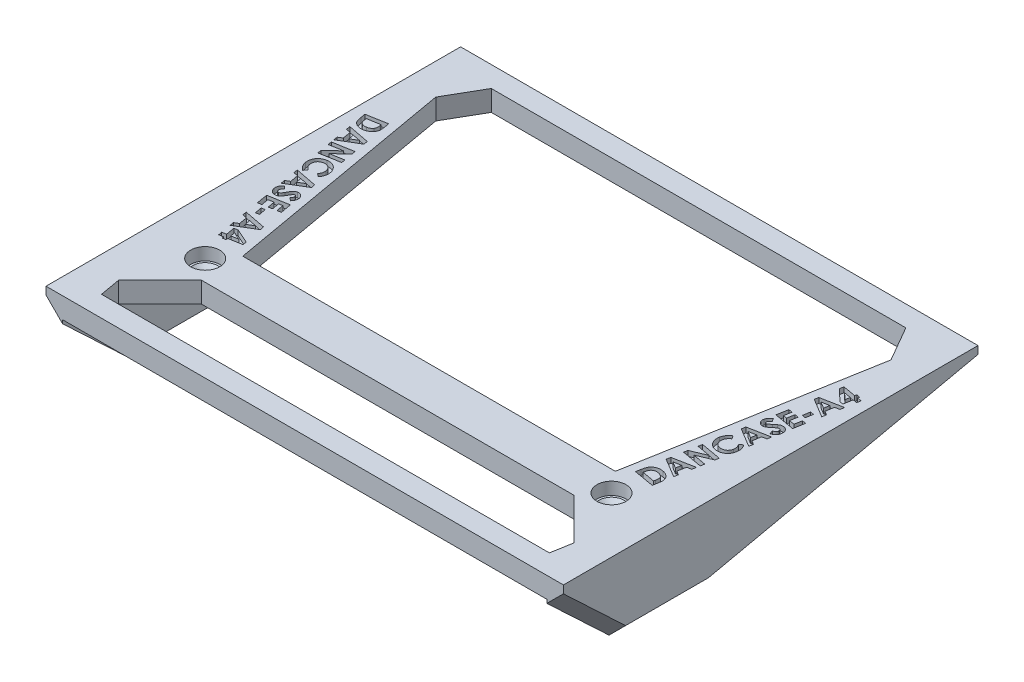
from build123d import *

# Parameters (mm, degrees)
BOSS_EXTRUDE1_DEPTH = 10
SKETCH2_R           = 3.5
CUT_EXTRUDE1_DEPTH  = 3
SKETCH3_R           = 1.5
CUT_EXTRUDE2_DEPTH  = 66.442799451
CHAMFER1_SIZE       = 1.5
CUT_EXTRUDE3_DEPTH  = 100.592971798
CUT_EXTRUDE4_DEPTH  = 1.25


with BuildPart() as part:
    # Sketch1 → Boss-Extrude1 (new, symmetric)
    with BuildSketch(Plane.XY):
        Polygon((-58.4, 0), (58.4, 0), (58.4, -15), (62.4, -11), (62.4, 5), (-62.4, 5), (-62.4, -11), (-58.4, -15), align=None)
    extrude(amount=BOSS_EXTRUDE1_DEPTH, both=True)

    # Sketch2 → Cut-Extrude1 (cut)
    with BuildSketch(Plane(origin=(0, 5, 0), x_dir=(1, 0, 0), z_dir=(0, 1, 0))):
        with Locations(Location((49, 0, 0), (0, 0, 270))):
            Circle(SKETCH2_R)
        with Locations(Location((-49, 0, 0), (0, 0, 180))):
            Circle(SKETCH2_R)
    extrude(amount=-CUT_EXTRUDE1_DEPTH, mode=Mode.SUBTRACT)

    # Sketch3 → Cut-Extrude2 (cut, through all)
    with BuildSketch(Plane(origin=(0, 2, 0), x_dir=(1, 0, 0), z_dir=(0, 1, 0))):
        with Locations(Location((49, 0, 0), (0, 0, 180))):
            Circle(SKETCH3_R)
        with Locations(Location((-49, 0, 0), (0, 0, 180))):
            Circle(SKETCH3_R)
    extrude(amount=-CUT_EXTRUDE2_DEPTH, mode=Mode.SUBTRACT)

    # Chamfer1
    chamfer1_edges = [part.edges().sort_by_distance(p)[0] for p in [
        (50.5, 2, 0),
        (-47.5, 2, 0),
    ]]
    chamfer(chamfer1_edges, length=CHAMFER1_SIZE)

    # Sketch4 → section 0 of loft1
    with BuildSketch(Plane.XY.offset(-75), mode=Mode.PRIVATE) as loft1_s0:
        with BuildLine():
            Line((58.4, -0.857864376), (62.4, 3.142135624))
            Line((62.4, 3.142135624), (62.4, 5))
            Line((62.4, 5), (-62.4, 5))
            Line((-62.4, 5), (-62.4, 3.142135624))
            Line((-62.4, 3.142135624), (-58.4, -0.857864376))
            Line((-58.4, -0.857864376), (-58.4, 0))
            Line((-58.4, 0), (58.4, 0))
            Line((58.4, 0), (58.4, -0.857864376))
        make_face()
    # loft up to a face of the part (loft1)
    loft([loft1_s0.sketch, part.faces().sort_by_distance((0, 1.206959707, -10))[0]])

    # Sketch5 → section 1 of loft2
    with BuildSketch(Plane.XY.offset(25), mode=Mode.PRIVATE) as loft2_s1:
        with BuildLine():
            Line((-58.4, 0), (58.4, 0))
            Line((58.4, 0), (58.4, -0.857864376))
            Line((58.4, -0.857864376), (62.4, 3.142135624))
            Line((62.4, 3.142135624), (62.4, 5))
            Line((62.4, 5), (-62.4, 5))
            Line((-62.4, 5), (-62.4, 3.142135624))
            Line((-62.4, 3.142135624), (-58.4, -0.857864376))
            Line((-58.4, -0.857864376), (-58.4, 0))
        make_face()
    # loft from a face of the part (loft2)
    loft([part.faces().sort_by_distance((0, 1.206959707, 10))[0], loft2_s1.sketch])

    # Sketch6 → Cut-Extrude3 (cut, through all)
    with BuildSketch(Plane(origin=(0, 5, 0), x_dir=(1, 0, 0), z_dir=(0, 1, 0))):
        Polygon((44.935241972, 5), (-44.935241972, 5), (-54.9, 61.512951043), (-50, 70), (50, 70), (54.9, 61.512951043), align=None)
        Polygon((44.935241972, -5), (-44.935241972, -5), (-54.9, -14.964758028), (-54.012150986, -20), (54.012150986, -20), (54.9, -14.964758028), align=None)
    extrude(amount=-CUT_EXTRUDE3_DEPTH, mode=Mode.SUBTRACT)

    # Sketch7 → Cut-Extrude4 (cut)
    # profile 1 of 20: a face of its own
    with BuildSketch(Plane(origin=(0, 5, 0), x_dir=(1, 0, 0), z_dir=(0, 1, 0))):
        with BuildLine():
            Line((47.42833982, 7.367029507), (47.622650718, 8.468792327))
            add(Edge.make_bspline(
                [(47.622650718, 8.468792327), (47.638306615, 8.5544052), (47.668634846, 8.72025241), (47.724158757, 8.958667131), (47.783670186, 9.179039778), (47.848439551, 9.380767009), (47.918583531, 9.563709433), (47.992910434, 9.728657213), (48.074216663, 9.874621764), (48.161442021, 10.003923584), (48.256163674, 10.120092643), (48.36003115, 10.226259076), (48.472187512, 10.325780391), (48.594308351, 10.417232851), (48.725458575, 10.501397063), (48.866387434, 10.57732929), (49.015721662, 10.646708143), (49.173730225, 10.707311838), (49.338294731, 10.759869876), (49.508896292, 10.799454873), (49.683848712, 10.828538222), (49.86313783, 10.847079918), (50.046898221, 10.851322673), (50.234461126, 10.845168068), (50.426559036, 10.828687971), (50.555116721, 10.80802089), (50.620447192, 10.797518289)],
                knots=[0, 0, 0, 0, 1.43894904, 2.787497666, 4.046405404, 5.212640783, 6.289158376, 7.284733822, 8.201664698, 9.048418289, 9.860633328, 10.676592175, 11.501836242, 12.337667263, 13.196784439, 14.076219577, 14.982720569, 15.917737894, 16.872814779, 17.83695933, 18.810807138, 19.803991875, 20.814652542, 21.847550151, 22.906167595, 24, 24, 24, 24], degree=3))
            add(Edge.make_bspline(
                [(50.620447192, 10.797518289), (50.712352249, 10.778861633), (50.89289144, 10.742212316), (51.1522676, 10.658857208), (51.39655707, 10.555889151), (51.622992449, 10.430465427), (51.831573922, 10.289073695), (52.017867509, 10.13148383), (52.180562724, 9.959141508), (52.318296566, 9.773932686), (52.432291087, 9.580970916), (52.522915673, 9.383900954), (52.585843973, 9.183146156), (52.620102916, 9.01117281), (52.633628194, 8.864318727), (52.634332782, 8.737185565), (52.630501371, 8.593177597), (52.619143248, 8.432146806), (52.600358121, 8.25425477), (52.577013603, 8.059377246), (52.543952508, 7.847563975), (52.519305876, 7.700869925), (52.50646482, 7.624441366)],
                knots=[0, 0, 0, 0, 1.321459185, 2.595887311, 3.83402008, 5.053949924, 6.239553283, 7.381802014, 8.487455182, 9.573971328, 10.629196974, 11.6425549, 12.625190949, 13.589064158, 14.109034805, 14.702266248, 15.380421129, 16.140110551, 16.977652082, 17.902559346, 18.907219703, 20, 20, 20, 20], degree=3))
            Line((52.50646482, 7.624441366), (52.309149115, 6.506652904))
            Line((52.309149115, 6.506652904), (47.42833982, 7.367029507))
        make_face()
        with BuildLine():
            Line((48.488035333, 8.135258673), (51.562955205, 7.592390084))
            Line((51.562955205, 7.592390084), (51.639077, 8.024080789))
            add(Edge.make_bspline(
                [(51.639077, 8.024080789), (51.647853289, 8.075432694), (51.664792975, 8.174550342), (51.682313909, 8.318649662), (51.695165504, 8.452540179), (51.700022597, 8.57625406), (51.699267617, 8.690251816), (51.692877557, 8.794058456), (51.679236175, 8.888017866), (51.650922056, 8.999301813), (51.598599278, 9.129211533), (51.508926048, 9.274528364), (51.390236907, 9.409185142), (51.272901081, 9.512773649), (51.166142203, 9.588978667), (51.079027815, 9.643228254), (50.985573281, 9.692275372), (50.886172304, 9.736351151), (50.780766787, 9.775369362), (50.669380833, 9.8093657), (50.551929866, 9.838340627), (50.47128191, 9.854022194), (50.430142705, 9.862021494)],
                knots=[0, 0, 0, 0, 1.226141472, 2.366655304, 3.416158048, 4.391475138, 5.279585264, 6.098778276, 6.837907361, 7.510765269, 8.797951066, 10.117550192, 11.510447721, 13.008317936, 13.791272628, 14.596012632, 15.422150468, 16.273582384, 17.153868831, 18.06623251, 19.013568814, 20, 20, 20, 20], degree=3))
            add(Edge.make_bspline(
                [(50.430142705, 9.862021494), (50.367173539, 9.872114394), (50.244396511, 9.891793491), (50.062334498, 9.902603138), (49.888705586, 9.897868549), (49.723652267, 9.878050959), (49.566981135, 9.843225447), (49.418895731, 9.79167963), (49.278611457, 9.725079399), (49.19287754, 9.668099711), (49.150094628, 9.639665725)],
                knots=[0, 0, 0, 0, 1.145761577, 2.234001365, 3.272660155, 4.264165347, 5.217787166, 6.151563543, 7.077593818, 8, 8, 8, 8], degree=3))
            add(Edge.make_bspline(
                [(49.150094628, 9.639665725), (49.11279623, 9.610967178), (49.037053922, 9.552688691), (48.938116846, 9.444060608), (48.847390221, 9.320392848), (48.767540252, 9.178752949), (48.696549903, 9.020745509), (48.634824243, 8.846189813), (48.582484388, 8.654649911), (48.556568965, 8.520410065), (48.543123474, 8.450763481)],
                knots=[0, 0, 0, 0, 0.824231297, 1.67377647, 2.5664853, 3.51094025, 4.520192374, 5.602122178, 6.755928253, 8, 8, 8, 8], degree=3))
            Line((48.543123474, 8.450763481), (48.488035333, 8.135258673))
        make_face(mode=Mode.SUBTRACT)
    # profile 2 of 20: a face of its own
    with BuildSketch(Plane(origin=(0, 5, 0), x_dir=(1, 0, 0), z_dir=(0, 1, 0))):
        Polygon((48.535736391, 13.648184265), (48.702002416, 14.589690675), (53.913340557, 15.60731888), (53.743068122, 14.641774009), (52.670351775, 14.437447086), (52.319790878, 12.447262791), (53.255287673, 11.871341316), (53.085015237, 10.905796445), align=None)
        Polygon((49.913941519, 13.898584906), (51.474438314, 12.95106888), (51.703805301, 14.248144201), align=None, mode=Mode.SUBTRACT)
    # profile 3 of 20: a face of its own
    with BuildSketch(Plane(origin=(0, 5, 0), x_dir=(1, 0, 0), z_dir=(0, 1, 0))):
        Polygon((49.164821597, 17.215107037), (49.321071597, 18.104530114), (52.902802366, 19.631974024), (49.690662943, 20.197879473), (49.853924161, 21.12636505), (54.734733456, 20.265988447), (54.577481853, 19.373560563), (51.006768712, 17.848119857), (54.20889211, 17.283216011), (54.045630892, 16.354730434), align=None)
    # profile 4 of 20: a face of its own
    with BuildSketch(Plane(origin=(0, 5, 0), x_dir=(1, 0, 0), z_dir=(0, 1, 0))):
        with BuildLine():
            Line((51.704964495, 26.596332693), (52.211775392, 25.83711795))
            add(Edge.make_bspline(
                [(52.211775392, 25.83711795), (52.146013047, 25.792005508), (52.017545187, 25.703877586), (51.845543542, 25.552665051), (51.691183748, 25.396016747), (51.561102856, 25.227294106), (51.449112247, 25.051301722), (51.360384711, 24.865106367), (51.290234628, 24.670318367), (51.262318315, 24.53513139), (51.248233726, 24.466925642)],
                knots=[0, 0, 0, 0, 1.109145889, 2.166735341, 3.182318407, 4.165878283, 5.126508307, 6.080607003, 7.031610598, 8, 8, 8, 8], degree=3))
            add(Edge.make_bspline(
                [(51.248233726, 24.466925642), (51.239480822, 24.409288874), (51.222294816, 24.296121184), (51.215244825, 24.126598235), (51.225776331, 23.961662045), (51.250168218, 23.800355474), (51.292714456, 23.643676132), (51.351278922, 23.491397627), (51.425938266, 23.343542189), (51.515578437, 23.201441639), (51.617733436, 23.067889223), (51.731406041, 22.94734789), (51.854153491, 22.840082457), (51.987282524, 22.747882643), (52.129390136, 22.668179449), (52.280828892, 22.601868371), (52.442443374, 22.550374172), (52.55440771, 22.527467085), (52.611414816, 22.515803847)],
                knots=[0, 0, 0, 0, 1.053454785, 2.068419994, 3.060199017, 4.037712953, 5.012894473, 5.989289544, 6.982702064, 8.002609267, 9.022802229, 10.017754015, 10.993309096, 11.964522034, 12.940114463, 13.9348465, 14.94851853, 16, 16, 16, 16], degree=3))
            add(Edge.make_bspline(
                [(52.611414816, 22.515803847), (52.651740892, 22.509234943), (52.731104608, 22.496307015), (52.84995805, 22.486779089), (52.966325035, 22.483552536), (53.080403416, 22.487511976), (53.192154877, 22.498512479), (53.301533409, 22.51666534), (53.40916935, 22.54135436), (53.513873907, 22.574980021), (53.616063754, 22.613265712), (53.713930329, 22.66002142), (53.807390606, 22.712925284), (53.89749494, 22.771200269), (53.98282529, 22.836573478), (54.063825364, 22.908887214), (54.141114314, 22.987165118), (54.213999213, 23.071165657), (54.282302781, 23.160213811), (54.344065779, 23.254022871), (54.399443761, 23.351810764), (54.448612715, 23.453182917), (54.491684732, 23.558587103), (54.528765975, 23.667540758), (54.559185704, 23.780654212), (54.574033271, 23.857845985), (54.581567059, 23.897013783)],
                knots=[0, 0, 0, 0, 1.090569344, 2.146294516, 3.180765, 4.197685383, 5.192082883, 6.176964013, 7.156545369, 8.137748013, 9.111266311, 10.068317995, 11.030339259, 11.977373555, 12.931306106, 13.897449159, 14.874552872, 15.866669961, 16.865174993, 17.869038234, 18.863115991, 19.863886878, 20.875400364, 21.901578752, 22.935242242, 24, 24, 24, 24], degree=3))
            add(Edge.make_bspline(
                [(54.581567059, 23.897013783), (54.591322694, 23.963318004), (54.610517809, 24.093777693), (54.614709276, 24.289243444), (54.60064169, 24.479451806), (54.569387887, 24.634172262), (54.535215407, 24.757473629), (54.500312716, 24.852741673), (54.459376999, 24.952218033), (54.41035172, 25.054748167), (54.353671917, 25.160375922), (54.290369921, 25.269495944), (54.220688178, 25.38292632), (54.169237609, 25.458060756), (54.142865136, 25.496573078)],
                knots=[0, 0, 0, 0, 1.410720845, 2.775723772, 4.109284949, 5.421133388, 6.093584563, 6.803297754, 7.556994136, 8.359274766, 9.196292425, 10.081820413, 11.016781733, 12, 12, 12, 12], degree=3))
            Line((54.142865136, 25.496573078), (54.909091098, 26.010395193))
            add(Edge.make_bspline(
                [(54.909091098, 26.010395193), (54.943925204, 25.958597382), (55.012123482, 25.85718753), (55.104673835, 25.703564882), (55.189584065, 25.554483248), (55.263567054, 25.408314974), (55.327945613, 25.266027959), (55.382369471, 25.127699493), (55.426514063, 24.992850364), (55.462510928, 24.860601232), (55.487794915, 24.728158851), (55.508809924, 24.594331195), (55.520216076, 24.457108264), (55.52520205, 24.316733717), (55.523521765, 24.172941287), (55.512636992, 24.026331941), (55.497477267, 23.876095241), (55.480579599, 23.775740954), (55.471991739, 23.724738142)],
                knots=[0, 0, 0, 0, 1.234899529, 2.417688632, 3.547625029, 4.628913742, 5.657840593, 6.636778781, 7.56848357, 8.464225141, 9.346492087, 10.23496948, 11.143457728, 12.068888497, 13.013640044, 13.986967584, 14.976921486, 16, 16, 16, 16], degree=3))
            add(Edge.make_bspline(
                [(55.471991739, 23.724738142), (55.453629169, 23.632189045), (55.417705501, 23.451130348), (55.336467646, 23.19094711), (55.235422527, 22.947734878), (55.113923795, 22.721024621), (54.971623178, 22.511531519), (54.810231105, 22.317836043), (54.62608391, 22.143105535), (54.424877861, 21.985767758), (54.209708735, 21.848414407), (53.982616516, 21.736930168), (53.747236074, 21.648982262), (53.502729325, 21.586796118), (53.249623923, 21.550031526), (52.988051241, 21.536873139), (52.717687094, 21.54996962), (52.536444153, 21.577370788), (52.444147187, 21.591324681)],
                knots=[0, 0, 0, 0, 1.088874197, 2.130222217, 3.141162033, 4.12604602, 5.094794562, 6.060777659, 7.031480291, 8.02014469, 9.006227626, 9.973448469, 10.93588638, 11.902699941, 12.880800108, 13.884391936, 14.922638296, 16, 16, 16, 16], degree=3))
            add(Edge.make_bspline(
                [(52.444147187, 21.591324681), (52.384222363, 21.602945691), (52.266243052, 21.625825003), (52.093943908, 21.672417335), (51.928753545, 21.728458479), (51.770134955, 21.793602246), (51.618079318, 21.867947836), (51.473095099, 21.951857747), (51.334921751, 22.045677547), (51.204270921, 22.148645341), (51.080648306, 22.259626305), (50.966698713, 22.379537813), (50.859342828, 22.505696786), (50.763291152, 22.641425488), (50.672699985, 22.782962282), (50.593465411, 22.933649236), (50.520701175, 23.09112637), (50.458086178, 23.255859701), (50.405512441, 23.424844976), (50.362934951, 23.596015869), (50.332168815, 23.768022661), (50.311547451, 23.941245389), (50.303929884, 24.115635392), (50.307050004, 24.290879937), (50.320400603, 24.467346445), (50.339270675, 24.58422015), (50.348794623, 24.643207693)],
                knots=[0, 0, 0, 0, 1.063434692, 2.093678088, 3.107427516, 4.101417927, 5.079756669, 6.054698874, 7.018063005, 7.987591385, 8.951517532, 9.910285425, 10.868258636, 11.835410031, 12.805496855, 13.79455428, 14.799450125, 15.827012326, 16.863022115, 17.881817548, 18.898634203, 19.906069982, 20.919468756, 21.9377657, 22.959165924, 24, 24, 24, 24], degree=3))
            add(Edge.make_bspline(
                [(50.348794623, 24.643207693), (50.358245514, 24.69307689), (50.377137473, 24.792763447), (50.415574549, 24.93984276), (50.461522984, 25.084359209), (50.51597647, 25.225551774), (50.576936122, 25.364203973), (50.646150128, 25.499660804), (50.723895092, 25.631862326), (50.807216286, 25.761823103), (50.898623365, 25.887147145), (50.996337208, 26.006783199), (51.099952443, 26.120497495), (51.209204609, 26.22795304), (51.324923114, 26.328735926), (51.444798385, 26.425818176), (51.572198307, 26.514599848), (51.66062895, 26.569039071), (51.704964495, 26.596332693)],
                knots=[0, 0, 0, 0, 0.992998121, 1.984964064, 2.972596045, 3.959038798, 4.944788975, 5.935312371, 6.933711921, 7.944919204, 8.955070661, 9.967290502, 10.966224315, 11.964132089, 12.964090888, 13.968096654, 14.981285913, 16, 16, 16, 16], degree=3))
        make_face()
    # profile 5 of 20: a face of its own
    with BuildSketch(Plane(origin=(0, 5, 0), x_dir=(1, 0, 0), z_dir=(0, 1, 0))):
        Polygon((51.25177199, 29.051587581), (51.418038016, 29.993093992), (56.629376157, 31.010722197), (56.459103721, 30.045177325), (55.386387375, 29.840850402), (55.035826477, 27.850666107), (55.971323272, 27.274744633), (55.801050836, 26.309199761), align=None)
        Polygon((52.629977118, 29.301988222), (54.190473913, 28.354472197), (54.4198409, 29.651547517), align=None, mode=Mode.SUBTRACT)
    # profile 6 of 20: a face of its own
    with BuildSketch(Plane(origin=(0, 5, 0), x_dir=(1, 0, 0), z_dir=(0, 1, 0))):
        with BuildLine():
            Line((52.994639247, 35.055409392), (53.481418094, 34.263141764))
            add(Edge.make_bspline(
                [(53.481418094, 34.263141764), (53.436352602, 34.240381736), (53.349672108, 34.196604329), (53.230295453, 34.123934264), (53.127164404, 34.04730616), (53.038895201, 33.968108425), (52.966068709, 33.884954442), (52.909245464, 33.798113685), (52.867396022, 33.708086663), (52.85333933, 33.645159254), (52.846402068, 33.614103302)],
                knots=[0, 0, 0, 0, 1.285749291, 2.473053752, 3.554849919, 4.554281387, 5.48874798, 6.361541685, 7.191387603, 8, 8, 8, 8], degree=3))
            add(Edge.make_bspline(
                [(52.846402068, 33.614103302), (52.842490523, 33.584787908), (52.834948732, 33.528265336), (52.838681858, 33.445130001), (52.856957834, 33.367906714), (52.888990545, 33.298626224), (52.930013288, 33.239071505), (52.978343979, 33.192412209), (53.032158402, 33.158542256), (53.072044105, 33.148381498), (53.091794696, 33.143350097)],
                knots=[0, 0, 0, 0, 1.208451578, 2.329997416, 3.383678211, 4.435142688, 5.435675797, 6.324595447, 7.170373652, 8, 8, 8, 8], degree=3))
            add(Edge.make_bspline(
                [(53.091794696, 33.143350097), (53.112471002, 33.140968262), (53.153492297, 33.136242759), (53.216219331, 33.141844353), (53.278518317, 33.157752072), (53.318068252, 33.176088772), (53.338188927, 33.185417405)],
                knots=[0, 0, 0, 0, 0.980524547, 1.945337204, 2.954708694, 4, 4, 4, 4], degree=3))
            add(Edge.make_bspline(
                [(53.338188927, 33.185417405), (53.354350757, 33.194547359), (53.391888723, 33.215752872), (53.45198255, 33.257827574), (53.526759192, 33.309639546), (53.613614136, 33.374789166), (53.712220212, 33.453807038), (53.826021526, 33.542008078), (53.950834457, 33.645158892), (54.038947159, 33.717306126), (54.08538444, 33.755329264)],
                knots=[0, 0, 0, 0, 0.473391609, 1.09951395, 1.869988968, 2.795139647, 3.868821269, 5.094176913, 6.468569017, 8, 8, 8, 8], degree=3))
            add(Edge.make_bspline(
                [(54.08538444, 33.755329264), (54.128155926, 33.791008946), (54.209694209, 33.859027627), (54.32474375, 33.956153531), (54.428961586, 34.040418351), (54.519209701, 34.114155793), (54.597342857, 34.176905736), (54.66209982, 34.228901161), (54.715970989, 34.267940889), (54.74711061, 34.290518741), (54.760464568, 34.300201058)],
                knots=[0, 0, 0, 0, 1.540578673, 2.936913192, 4.164241334, 5.247334312, 6.160222991, 6.936123831, 7.54376588, 8, 8, 8, 8], degree=3))
            add(Edge.make_bspline(
                [(54.760464568, 34.300201058), (54.8146372, 34.336539564), (54.918338133, 34.406101202), (55.076699172, 34.491159687), (55.227179473, 34.558790809), (55.373639957, 34.606044861), (55.518946842, 34.634220324), (55.665618124, 34.647738633), (55.815833661, 34.643543453), (55.915752221, 34.629057442), (55.966394055, 34.621715482)],
                knots=[0, 0, 0, 0, 1.218177266, 2.331917688, 3.354236522, 4.29727151, 5.200165954, 6.114559973, 7.04440036, 8, 8, 8, 8], degree=3))
            add(Edge.make_bspline(
                [(55.966394055, 34.621715482), (56.015419799, 34.612140627), (56.111432992, 34.593389003), (56.248495342, 34.54683779), (56.377277973, 34.490770739), (56.498421535, 34.424143019), (56.609187801, 34.343062251), (56.71058618, 34.250105934), (56.804475194, 34.146623165), (56.888038331, 34.031594832), (56.960831565, 33.908325471), (57.020632244, 33.778194707), (57.065336674, 33.642307424), (57.098124922, 33.500913788), (57.115421028, 33.353497618), (57.120508776, 33.200382994), (57.111738965, 33.041749404), (57.094814572, 32.93523584), (57.086185722, 32.880930225)],
                knots=[0, 0, 0, 0, 1.031511158, 2.020136198, 2.984347577, 3.932846471, 4.871527866, 5.814385981, 6.772104614, 7.754931499, 8.747978864, 9.726945561, 10.709021022, 11.700124034, 12.722195738, 13.771764204, 14.863940795, 16, 16, 16, 16], degree=3))
            add(Edge.make_bspline(
                [(57.086185722, 32.880930225), (57.078139831, 32.838385268), (57.062233315, 32.754275001), (57.02767657, 32.632281587), (56.986759241, 32.515756581), (56.938540645, 32.404777443), (56.882455918, 32.299699823), (56.818917192, 32.2001065), (56.748955774, 32.105744086), (56.671135533, 32.017124305), (56.586037058, 31.933312678), (56.490831285, 31.856656224), (56.389140666, 31.783033917), (56.27772667, 31.716158977), (56.158846174, 31.652556886), (56.030210823, 31.59617933), (55.893939002, 31.543668602), (55.799303055, 31.5138982), (55.751049504, 31.498718687)],
                knots=[0, 0, 0, 0, 1.018636842, 2.013818363, 2.980581377, 3.923646487, 4.858722858, 5.78079965, 6.701737373, 7.620560733, 8.554084067, 9.508893821, 10.494505617, 11.506574856, 12.564607393, 13.665622948, 14.80973366, 16, 16, 16, 16], degree=3))
            Line((55.751049504, 31.498718687), (55.416514247, 32.361098494))
            add(Edge.make_bspline(
                [(55.416514247, 32.361098494), (55.472586848, 32.38131291), (55.579958842, 32.420020979), (55.729250848, 32.488596756), (55.857993697, 32.56584897), (55.968241626, 32.649156621), (56.058290287, 32.740520071), (56.128633426, 32.839131685), (56.181025326, 32.944464487), (56.198204472, 33.019674554), (56.206778671, 33.057212276)],
                knots=[0, 0, 0, 0, 1.293310528, 2.476527398, 3.558889411, 4.545851864, 5.468163893, 6.330702383, 7.166845179, 8, 8, 8, 8], degree=3))
            add(Edge.make_bspline(
                [(56.206778671, 33.057212276), (56.211714947, 33.095863531), (56.221278419, 33.170745917), (56.214410568, 33.282231343), (56.186886454, 33.387256209), (56.140707726, 33.482778113), (56.083293623, 33.567336882), (56.012713488, 33.632517878), (55.933516856, 33.680758436), (55.874814818, 33.695039602), (55.845200145, 33.702244328)],
                knots=[0, 0, 0, 0, 1.14189739, 2.212295646, 3.255797914, 4.30787034, 5.313837171, 6.236129281, 7.110142426, 8, 8, 8, 8], degree=3))
            add(Edge.make_bspline(
                [(55.845200145, 33.702244328), (55.817189338, 33.705608846), (55.760145577, 33.712460656), (55.671494969, 33.703310536), (55.580905155, 33.678582296), (55.503999741, 33.645559462), (55.437927085, 33.609741599), (55.380495776, 33.573821513), (55.316226712, 33.528952994), (55.243907686, 33.477220053), (55.165235733, 33.415801736), (55.07907224, 33.346708866), (54.985939116, 33.269541626), (54.921981588, 33.214886039), (54.888669696, 33.186419007)],
                knots=[0, 0, 0, 0, 0.904452762, 1.841910027, 2.84136589, 3.913571025, 4.523301456, 5.255783202, 6.089146778, 7.042134486, 8.113104021, 9.296192041, 10.591737991, 12, 12, 12, 12], degree=3))
            add(Edge.make_bspline(
                [(54.888669696, 33.186419007), (54.825067596, 33.132134837), (54.702644012, 33.027646734), (54.52401414, 32.880615875), (54.357517198, 32.749820993), (54.202980147, 32.635597759), (54.061704791, 32.536001213), (53.931709565, 32.453692869), (53.81528692, 32.385364397), (53.677129025, 32.320041967), (53.514815296, 32.260712223), (53.323864618, 32.219381298), (53.1374799, 32.203208745), (53.016921721, 32.219074317), (52.957579953, 32.226883751)],
                knots=[0, 0, 0, 0, 1.351034414, 2.600519106, 3.737913985, 4.771508269, 5.705306867, 6.5298796, 7.257188875, 7.884545825, 8.997108281, 10.040370523, 11.035421071, 12, 12, 12, 12], degree=3))
            add(Edge.make_bspline(
                [(52.957579953, 32.226883751), (52.9163147, 32.235424479), (52.834705992, 32.252315148), (52.716913931, 32.291495527), (52.60642884, 32.343448016), (52.501279632, 32.404257301), (52.403504367, 32.477988163), (52.313669765, 32.564006114), (52.228537203, 32.659409217), (52.152619396, 32.765830225), (52.085609997, 32.879326855), (52.030336104, 32.998082706), (51.986757335, 33.120384095), (51.95730086, 33.246798862), (51.937030927, 33.376371871), (51.933592344, 33.50995687), (51.938328428, 33.647144225), (51.952676536, 33.738732757), (51.959983799, 33.78537734)],
                knots=[0, 0, 0, 0, 0.981519677, 1.941113814, 2.884515, 3.822639276, 4.767226909, 5.730441872, 6.717129097, 7.742835048, 8.771693898, 9.784660248, 10.791151222, 11.791367028, 12.805915929, 13.841490314, 14.90070532, 16, 16, 16, 16], degree=3))
            add(Edge.make_bspline(
                [(51.959983799, 33.78537734), (51.972883956, 33.845205533), (51.998555911, 33.964266615), (52.0628877, 34.135396895), (52.147081278, 34.298064528), (52.232958555, 34.427100004), (52.313945869, 34.526836622), (52.38476259, 34.602242033), (52.464384147, 34.677785985), (52.553446636, 34.753084023), (52.650425467, 34.829266789), (52.756852195, 34.905214398), (52.872053324, 34.98148859), (52.953053555, 35.030332714), (52.994639247, 35.055409392)],
                knots=[0, 0, 0, 0, 1.297959113, 2.583003275, 3.86689359, 5.18009119, 5.865323284, 6.592493127, 7.374619854, 8.194167617, 9.067605864, 9.992096453, 10.969138011, 12, 12, 12, 12], degree=3))
        make_face()
    # profile 7 of 20: a face of its own
    with BuildSketch(Plane(origin=(0, 5, 0), x_dir=(1, 0, 0), z_dir=(0, 1, 0))):
        Polygon((52.504209629, 36.153717672), (52.973961231, 38.817980492), (53.88341636, 38.657724082), (53.575924372, 36.915937223), (54.458336231, 36.760688826), (54.765828219, 38.502475685), (55.658256103, 38.345224082), (55.350764116, 36.603437223), (56.634818603, 36.377075044), (56.94231059, 38.118861903), (57.854770526, 37.95760389), (57.385018924, 35.293341069), align=None)
    # profile 8 of 20: a face of its own
    with BuildSketch(Plane(origin=(0, 5, 0), x_dir=(1, 0, 0), z_dir=(0, 1, 0))):
        Polygon((55.792826485, 39.243211849), (56.090302446, 40.928908965), (56.932650202, 40.779670183), (56.635174241, 39.093973067), align=None)
    # profile 9 of 20: a face of its own
    with BuildSketch(Plane(origin=(0, 5, 0), x_dir=(1, 0, 0), z_dir=(0, 1, 0))):
        Polygon((53.889888535, 44.013089983), (54.056154561, 44.954596393), (59.267492702, 45.972224598), (59.097220266, 45.006679727), (58.02450392, 44.802352803), (57.673943023, 42.812168509), (58.609439818, 42.236247034), (58.439167382, 41.270702162), align=None)
        Polygon((55.268093664, 44.263490624), (56.828590459, 43.315974598), (57.057957446, 44.613049919), align=None, mode=Mode.SUBTRACT)
    # profile 10 of 20: a face of its own
    with BuildSketch(Plane(origin=(0, 5, 0), x_dir=(1, 0, 0), z_dir=(0, 1, 0))):
        Polygon((54.69425419, 49.290749934), (54.858517011, 50.219235511), (58.000544254, 49.665349293), (58.076666049, 50.100044806), (58.936041049, 49.947801216), (58.859919254, 49.513105704), (59.861521818, 49.336823652), (59.701265408, 48.428370127), (58.699662844, 48.604652178), (58.324061883, 46.474243524), (57.464686883, 46.626487114), align=None)
        Polygon((57.840287844, 48.756895768), (56.204670857, 49.045357306), (57.642972139, 47.642112114), align=None, mode=Mode.SUBTRACT)
    # profile 11 of 20: a face of its own
    with BuildSketch(Plane(origin=(0, 5, 0), x_dir=(1, 0, 0), z_dir=(0, 1, 0))):
        Polygon((-47.478228644, 8.366290095), (-47.313965824, 7.437804518), (-50.455993068, 6.8839183), (-50.379871273, 6.449222788), (-51.239246273, 6.296979198), (-51.315368068, 6.731674711), (-52.316970632, 6.555392659), (-52.477227042, 7.463846185), (-51.475624478, 7.640128236), (-51.851225439, 9.77053689), (-50.991850439, 9.92278048), align=None)
        Polygon((-50.616249478, 7.792371826), (-48.980632491, 8.080833365), (-50.813565183, 8.90715548), align=None, mode=Mode.SUBTRACT)
    # profile 12 of 20: a face of its own
    with BuildSketch(Plane(origin=(0, 5, 0), x_dir=(1, 0, 0), z_dir=(0, 1, 0))):
        Polygon((-48.526985325, 13.599879534), (-48.360719299, 12.658373124), (-52.910999748, 9.919991713), (-53.081272184, 10.885536585), (-52.142770581, 11.444430816), (-52.493331479, 13.434615111), (-53.569052632, 13.655969277), (-53.739325068, 14.621514149), align=None)
        Polygon((-49.736921222, 12.894751329), (-51.527786607, 13.249318636), (-51.29841962, 11.952243316), align=None, mode=Mode.SUBTRACT)
    # profile 13 of 20: a face of its own
    with BuildSketch(Plane(origin=(0, 5, 0), x_dir=(1, 0, 0), z_dir=(0, 1, 0))):
        Polygon((-51.946563401, 17.432257668), (-51.64908744, 15.746560552), (-52.491435196, 15.59732177), (-52.788911158, 17.283018886), align=None)
    # profile 14 of 20: a face of its own
    with BuildSketch(Plane(origin=(0, 5, 0), x_dir=(1, 0, 0), z_dir=(0, 1, 0))):
        Polygon((-49.912664231, 21.459251845), (-49.442912629, 18.794989025), (-50.352367757, 18.634732614), (-50.659859744, 20.376519473), (-51.542271603, 20.221271076), (-51.234779616, 18.479484217), (-52.127207501, 18.322232614), (-52.434699488, 20.064019473), (-53.718753975, 19.837657294), (-53.411261988, 18.095870435), (-54.323721924, 17.934612422), (-54.793473526, 20.598875242), align=None)
    # profile 15 of 20: a face of its own
    with BuildSketch(Plane(origin=(0, 5, 0), x_dir=(1, 0, 0), z_dir=(0, 1, 0))):
        with BuildLine():
            Line((-50.750359613, 22.323185125), (-51.477523074, 22.90311301))
            add(Edge.make_bspline(
                [(-51.477523074, 22.90311301), (-51.442836731, 22.939620098), (-51.376203667, 23.009750846), (-51.290291851, 23.119585078), (-51.217658944, 23.225810185), (-51.162404756, 23.330611275), (-51.123100989, 23.433580725), (-51.100194361, 23.53395573), (-51.090111742, 23.632772491), (-51.098681273, 23.696757186), (-51.102923715, 23.728433523)],
                knots=[0, 0, 0, 0, 1.284354551, 2.467267284, 3.554243808, 4.564127003, 5.483523256, 6.357754947, 7.186988281, 8, 8, 8, 8], degree=3))
            add(Edge.make_bspline(
                [(-51.102923715, 23.728433523), (-51.108835689, 23.757480733), (-51.120219691, 23.813413571), (-51.15462632, 23.88949486), (-51.197769554, 23.956261189), (-51.251679122, 24.010436546), (-51.310204087, 24.052717627), (-51.370945196, 24.080984719), (-51.433449113, 24.092945776), (-51.474175051, 24.088987549), (-51.494550318, 24.08700724)],
                knots=[0, 0, 0, 0, 1.209030272, 2.328089106, 3.392476312, 4.445145783, 5.434233931, 6.332812475, 7.165902792, 8, 8, 8, 8], degree=3))
            add(Edge.make_bspline(
                [(-51.494550318, 24.08700724), (-51.51477571, 24.0823027), (-51.554975796, 24.072951932), (-51.612737363, 24.047194731), (-51.665700368, 24.009696005), (-51.69696335, 23.978639564), (-51.712899677, 23.962808523)],
                knots=[0, 0, 0, 0, 0.973036459, 1.934011853, 2.946861121, 4, 4, 4, 4], degree=3))
            add(Edge.make_bspline(
                [(-51.712899677, 23.962808523), (-51.724660328, 23.948513942), (-51.751863472, 23.915449658), (-51.796242163, 23.857310292), (-51.846274744, 23.781838537), (-51.905918794, 23.69117135), (-51.973820232, 23.584594531), (-52.048338652, 23.461147962), (-52.132151608, 23.32266126), (-52.189475624, 23.224380993), (-52.219710574, 23.172544099)],
                knots=[0, 0, 0, 0, 0.472778924, 1.093568065, 1.866961585, 2.784616104, 3.865688178, 5.094137041, 6.467333126, 8, 8, 8, 8], degree=3))
            add(Edge.make_bspline(
                [(-52.219710574, 23.172544099), (-52.247765554, 23.124139355), (-52.300802395, 23.032632081), (-52.376052304, 22.902441422), (-52.444242344, 22.788029915), (-52.503330295, 22.687138326), (-52.554812765, 22.601488275), (-52.599470168, 22.531072621), (-52.634916131, 22.474902617), (-52.656993928, 22.442988398), (-52.666425318, 22.429354997)],
                knots=[0, 0, 0, 0, 1.548204198, 2.926819385, 4.16114261, 5.233854292, 6.162355863, 6.92623207, 7.541298228, 8, 8, 8, 8], degree=3))
            add(Edge.make_bspline(
                [(-52.666425318, 22.429354997), (-52.704980756, 22.376933292), (-52.779005522, 22.276285897), (-52.899042992, 22.142002347), (-53.017399741, 22.026634481), (-53.139052199, 21.932244456), (-53.265248949, 21.855898584), (-53.398787865, 21.794728464), (-53.540537476, 21.745567902), (-53.639690823, 21.725438563), (-53.690063138, 21.715212369)],
                knots=[0, 0, 0, 0, 1.21533919, 2.333398444, 3.361505241, 4.299913083, 5.204014858, 6.111210968, 7.040449159, 8, 8, 8, 8], degree=3))
            add(Edge.make_bspline(
                [(-53.690063138, 21.715212369), (-53.739380096, 21.70801498), (-53.836001604, 21.693913898), (-53.980616403, 21.687597638), (-54.120925301, 21.696675076), (-54.257223153, 21.719805587), (-54.388966487, 21.756818753), (-54.516283978, 21.808797628), (-54.639743544, 21.873750291), (-54.757371344, 21.953258617), (-54.868696298, 22.043164192), (-54.967559415, 22.146685746), (-55.058108583, 22.258069273), (-55.135458965, 22.381160131), (-55.204646044, 22.512554688), (-55.260131988, 22.655338002), (-55.306786161, 22.807235296), (-55.32793302, 22.9132388), (-55.338700959, 22.967215574)],
                knots=[0, 0, 0, 0, 1.029782098, 2.017543319, 2.985726576, 3.930833498, 4.870279229, 5.808380485, 6.768486866, 7.748502719, 8.73908072, 9.720068089, 10.701953253, 11.70129146, 12.719912798, 13.766940921, 14.862930763, 16, 16, 16, 16], degree=3))
            add(Edge.make_bspline(
                [(-55.338700959, 22.967215574), (-55.345225879, 23.010219334), (-55.358032737, 23.094625427), (-55.368180542, 23.220758261), (-55.369334628, 23.34428606), (-55.36114883, 23.465091852), (-55.345281271, 23.583329738), (-55.32032866, 23.69860801), (-55.285846727, 23.810898968), (-55.243956306, 23.921134655), (-55.191268044, 24.028285004), (-55.130105365, 24.133985505), (-55.058680351, 24.237406698), (-54.976804722, 24.338350881), (-54.88718155, 24.438982415), (-54.785845784, 24.535968277), (-54.676065169, 24.632568904), (-54.596890242, 24.693105602), (-54.556449356, 24.724026471)],
                knots=[0, 0, 0, 0, 1.023169329, 2.008236642, 2.97448784, 3.927071429, 4.854712227, 5.779187858, 6.698643675, 7.616252013, 8.550785428, 9.504696074, 10.487411452, 11.504440833, 12.561282357, 13.655672471, 14.802566883, 16, 16, 16, 16], degree=3))
            Line((-54.556449356, 24.724026471), (-53.947474997, 24.027912689))
            add(Edge.make_bspline(
                [(-53.947474997, 24.027912689), (-53.993628355, 23.990024031), (-54.081775355, 23.91766155), (-54.196717589, 23.800440293), (-54.291420162, 23.684184363), (-54.367791822, 23.568770948), (-54.420098917, 23.45138884), (-54.453244631, 23.335144174), (-54.465766152, 23.218159565), (-54.456122086, 23.141775681), (-54.451281087, 23.103433523)],
                knots=[0, 0, 0, 0, 1.29541232, 2.474071536, 3.556087121, 4.547127648, 5.468382265, 6.333452148, 7.163448643, 8, 8, 8, 8], degree=3))
            add(Edge.make_bspline(
                [(-54.451281087, 23.103433523), (-54.442885721, 23.065317921), (-54.42662823, 22.99150767), (-54.381404848, 22.889331529), (-54.320808206, 22.799545967), (-54.244815722, 22.725383832), (-54.160851773, 22.667207301), (-54.072396009, 22.629087491), (-53.981366726, 22.611107588), (-53.921456483, 22.617468369), (-53.891385254, 22.620661087)],
                knots=[0, 0, 0, 0, 1.143431748, 2.214237238, 3.258150207, 4.304682555, 5.313258622, 6.23987796, 7.116527839, 8, 8, 8, 8], degree=3))
            add(Edge.make_bspline(
                [(-53.891385254, 22.620661087), (-53.863647879, 22.626928239), (-53.80727005, 22.639666592), (-53.727483143, 22.679777647), (-53.650733358, 22.733535282), (-53.589693548, 22.790839646), (-53.540272781, 22.847333785), (-53.497926818, 22.900421666), (-53.453597113, 22.965264155), (-53.403480488, 23.038586042), (-53.350196433, 23.122519142), (-53.293124793, 23.21670654), (-53.232586343, 23.321547363), (-53.190887538, 23.394875324), (-53.169229805, 23.432960766)],
                knots=[0, 0, 0, 0, 0.91077247, 1.851198067, 2.845166645, 3.915402527, 4.531002187, 5.256444873, 6.095738055, 7.053803283, 8.110240264, 9.289544431, 10.592230055, 12, 12, 12, 12], degree=3))
            add(Edge.make_bspline(
                [(-53.169229805, 23.432960766), (-53.128151699, 23.505929539), (-53.049320996, 23.64595984), (-52.930796176, 23.844472769), (-52.818960748, 24.024049819), (-52.712693737, 24.184087936), (-52.61404273, 24.326281683), (-52.520179511, 24.448051242), (-52.433240432, 24.551314995), (-52.326717902, 24.660489017), (-52.194633849, 24.772303317), (-52.029783299, 24.877503619), (-51.85937167, 24.954618773), (-51.741195737, 24.981961503), (-51.6828516, 24.995460766)],
                knots=[0, 0, 0, 0, 1.35322062, 2.596890217, 3.736189095, 4.771759227, 5.701345848, 6.532345088, 7.255703558, 7.881458699, 8.995799611, 10.043610884, 11.034119447, 12, 12, 12, 12], degree=3))
            add(Edge.make_bspline(
                [(-51.6828516, 24.995460766), (-51.640873937, 25.001711693), (-51.558232432, 25.014017903), (-51.434248928, 25.016590507), (-51.312682852, 25.006704837), (-51.193646391, 24.983262408), (-51.076332895, 24.948655924), (-50.962877724, 24.898324822), (-50.850946028, 24.837166189), (-50.743000432, 24.76325202), (-50.640293966, 24.680352553), (-50.547681695, 24.587380984), (-50.465292768, 24.487216938), (-50.393686764, 24.379039879), (-50.332308307, 24.263294151), (-50.281614445, 24.13972156), (-50.239492342, 24.008951491), (-50.221602328, 23.917962318), (-50.212499036, 23.871662689)],
                knots=[0, 0, 0, 0, 0.988409301, 1.945883253, 2.882963359, 3.826162974, 4.769073614, 5.727559026, 6.713207317, 7.738457956, 8.772765132, 9.785266322, 10.791648174, 11.790964643, 12.804004, 13.840212343, 14.900997071, 16, 16, 16, 16], degree=3))
            add(Edge.make_bspline(
                [(-50.212499036, 23.871662689), (-50.203477316, 23.811032242), (-50.18554815, 23.690539324), (-50.188453655, 23.507371929), (-50.209746597, 23.325067), (-50.247687832, 23.174224984), (-50.29052921, 23.052961365), (-50.3304254, 22.957690444), (-50.380076846, 22.859784329), (-50.437074505, 22.758211082), (-50.503881915, 22.654215059), (-50.577818744, 22.54617692), (-50.659935345, 22.434599661), (-50.719666702, 22.361002809), (-50.750359613, 22.323185125)],
                knots=[0, 0, 0, 0, 1.297687071, 2.578936977, 3.869596863, 5.182962406, 5.865783348, 6.595430872, 7.371016451, 8.191953368, 9.06386016, 9.990591931, 10.967467239, 12, 12, 12, 12], degree=3))
        make_face()
    # profile 16 of 20: a face of its own
    with BuildSketch(Plane(origin=(0, 5, 0), x_dir=(1, 0, 0), z_dir=(0, 1, 0))):
        Polygon((-51.16510187, 28.561381935), (-50.998835844, 27.619875525), (-55.549116293, 24.881494115), (-55.719388729, 25.847038987), (-54.780887127, 26.405933217), (-55.131448024, 28.396117512), (-56.207169178, 28.617471679), (-56.377441614, 29.583016551), align=None)
        Polygon((-52.375037768, 27.85625373), (-54.165903152, 28.210821038), (-53.936536165, 26.913745717), align=None, mode=Mode.SUBTRACT)
    # profile 17 of 20: a face of its own
    with BuildSketch(Plane(origin=(0, 5, 0), x_dir=(1, 0, 0), z_dir=(0, 1, 0))):
        with BuildLine():
            Line((-52.430659365, 30.714152849), (-53.165835647, 31.255018234))
            add(Edge.make_bspline(
                [(-53.165835647, 31.255018234), (-53.119927976, 31.320028447), (-53.030020446, 31.447347204), (-52.917917825, 31.646888882), (-52.828543726, 31.84807136), (-52.762062834, 32.050381883), (-52.718642931, 32.25457912), (-52.697067542, 32.45969668), (-52.699706578, 32.666531887), (-52.719287424, 32.802972686), (-52.729136929, 32.871604772)],
                knots=[0, 0, 0, 0, 1.107616098, 2.169202321, 3.180749162, 4.16867855, 5.128794599, 6.08217909, 7.035302854, 8, 8, 8, 8], degree=3))
            add(Edge.make_bspline(
                [(-52.729136929, 32.871604772), (-52.740778324, 32.928620431), (-52.763642508, 33.040601565), (-52.815407016, 33.201967504), (-52.880619093, 33.354006957), (-52.959831548, 33.496884143), (-53.053562353, 33.629530382), (-53.16059227, 33.75268129), (-53.281107799, 33.866036383), (-53.414037325, 33.968284469), (-53.554737214, 34.059501539), (-53.70278482, 34.133644108), (-53.854695749, 34.192230996), (-54.011087003, 34.234658783), (-54.171886567, 34.260579579), (-54.336940595, 34.27068753), (-54.506445745, 34.26375384), (-54.619615895, 34.24655176), (-54.677253917, 34.23779067)],
                knots=[0, 0, 0, 0, 1.051822227, 2.06582276, 3.058474288, 4.039655029, 5.01464788, 5.990519112, 6.985793334, 8.001536246, 9.019913987, 10.013648444, 10.990359938, 11.960028198, 12.938809256, 13.930909688, 14.946203819, 16, 16, 16, 16], degree=3))
            add(Edge.make_bspline(
                [(-54.677253917, 34.23779067), (-54.717117278, 34.230361347), (-54.796091679, 34.215642911), (-54.911056648, 34.183579026), (-55.022162416, 34.148434154), (-55.128462904, 34.105634169), (-55.230110452, 34.057239638), (-55.326506579, 34.001273511), (-55.41950365, 33.941395158), (-55.506965548, 33.874449486), (-55.589412509, 33.802291766), (-55.66543219, 33.725028973), (-55.735704265, 33.643739826), (-55.800520889, 33.558119693), (-55.858374667, 33.467294778), (-55.909208618, 33.371397176), (-55.955840115, 33.272080359), (-56.008902406, 33.133389423), (-56.058756367, 32.953073668), (-56.086598691, 32.7290163), (-56.090715595, 32.498964724), (-56.068004037, 32.345591824), (-56.056460647, 32.267638426)],
                knots=[0, 0, 0, 0, 0.901868083, 1.786715634, 2.653635978, 3.493785857, 4.334461118, 5.156414004, 5.972402695, 6.794086947, 7.604782683, 8.408538603, 9.203872939, 9.99433471, 10.796027951, 11.597066903, 12.408068941, 13.235876385, 14.89935663, 16.555271519, 18.249180345, 20, 20, 20, 20], degree=3))
            add(Edge.make_bspline(
                [(-56.056460647, 32.267638426), (-56.043241693, 32.201820813), (-56.017245553, 32.072385161), (-55.95359131, 31.887579135), (-55.875740816, 31.713831207), (-55.795138242, 31.578096853), (-55.718395567, 31.475627154), (-55.654248367, 31.39679501), (-55.580778314, 31.318081717), (-55.499880206, 31.238262609), (-55.411176568, 31.157513359), (-55.313846886, 31.076864345), (-55.209028729, 30.994479393), (-55.134872265, 30.941555328), (-55.096925391, 30.914473362)],
                knots=[0, 0, 0, 0, 1.412359074, 2.777518171, 4.105377201, 5.417281119, 6.090857141, 6.800249459, 7.556523636, 8.356969283, 9.193147243, 10.081662829, 11.018360708, 12, 12, 12, 12], degree=3))
            Line((-55.096925391, 30.914473362), (-55.642798788, 30.168279452))
            add(Edge.make_bspline(
                [(-55.642798788, 30.168279452), (-55.693082956, 30.205399711), (-55.791358441, 30.277947625), (-55.932290957, 30.389114782), (-56.061843856, 30.501183661), (-56.182179004, 30.612089599), (-56.289763492, 30.725048798), (-56.38965074, 30.835527986), (-56.478004975, 30.946898812), (-56.556180514, 31.059386086), (-56.625563738, 31.174929227), (-56.689903141, 31.294016179), (-56.748259748, 31.418688564), (-56.800067911, 31.549342323), (-56.847117297, 31.684961776), (-56.888055154, 31.826136456), (-56.924692909, 31.972326138), (-56.943401136, 32.072548251), (-56.952894942, 32.123407657)],
                knots=[0, 0, 0, 0, 1.23686204, 2.417325829, 3.551064159, 4.626265546, 5.654267359, 6.636980174, 7.572890001, 8.465467346, 9.345906246, 10.238654754, 11.143135276, 12.06823121, 13.018949924, 13.98280212, 14.976338819, 16, 16, 16, 16], degree=3))
            add(Edge.make_bspline(
                [(-56.952894942, 32.123407657), (-56.967412172, 32.21669013), (-56.995814688, 32.399194446), (-57.006703297, 32.67167585), (-56.995196235, 32.93478991), (-56.960007221, 33.189509966), (-56.896678616, 33.434527198), (-56.810669344, 33.671134675), (-56.698617632, 33.898663013), (-56.562524321, 34.115077971), (-56.406524973, 34.317344801), (-56.232079113, 34.501027021), (-56.041053833, 34.66434042), (-55.832320951, 34.805809844), (-55.607589136, 34.927739893), (-55.366048653, 35.028951871), (-55.107721489, 35.109681444), (-54.928043, 35.145848384), (-54.836508724, 35.164273041)],
                knots=[0, 0, 0, 0, 1.089355572, 2.131290963, 3.142415983, 4.127609926, 5.094438932, 6.059175, 7.029870172, 8.017173901, 9.00653034, 9.974588374, 10.937188352, 11.902763679, 12.88087947, 13.884724252, 14.92240728, 16, 16, 16, 16], degree=3))
            add(Edge.make_bspline(
                [(-54.836508724, 35.164273041), (-54.776522205, 35.174133529), (-54.65766405, 35.193671242), (-54.479863949, 35.207837242), (-54.30529125, 35.212235244), (-54.134290636, 35.205332257), (-53.966032411, 35.187042559), (-53.801122641, 35.158727876), (-53.639744363, 35.116696991), (-53.481599141, 35.065077061), (-53.327985749, 35.001729276), (-53.178635366, 34.92967167), (-53.035530221, 34.846343307), (-52.897809873, 34.752750605), (-52.76545799, 34.649213846), (-52.637636272, 34.536145482), (-52.517069163, 34.411192365), (-52.400775331, 34.278879416), (-52.293658632, 34.138256981), (-52.194602954, 33.992560083), (-52.106708422, 33.841564564), (-52.02928847, 33.685558201), (-51.961988205, 33.52497832), (-51.905067009, 33.359318583), (-51.857082384, 33.188935588), (-51.834867303, 33.072450206), (-51.823688211, 33.013832336)],
                knots=[0, 0, 0, 0, 1.059135481, 2.098586312, 3.105540036, 4.101420102, 5.078819322, 6.053668914, 7.014788653, 7.982701462, 8.950911582, 9.908625556, 10.870748836, 11.834278833, 12.808555142, 13.797748626, 14.805912187, 15.832843796, 16.866348885, 17.884738033, 18.901729756, 19.908834789, 20.918206737, 21.934015805, 22.960353735, 24, 24, 24, 24], degree=3))
            add(Edge.make_bspline(
                [(-51.823688211, 33.013832336), (-51.815899727, 32.963479101), (-51.800416983, 32.863381808), (-51.785096397, 32.712338845), (-51.778973021, 32.561140875), (-51.782726441, 32.409730006), (-51.79189246, 32.258506037), (-51.811616254, 32.107469508), (-51.838536988, 31.956358463), (-51.873406395, 31.805516236), (-51.916465503, 31.656822006), (-51.966572988, 31.510925936), (-52.024527132, 31.36869071), (-52.090940865, 31.23051972), (-52.164181731, 31.095599675), (-52.245440434, 30.964763474), (-52.33355818, 30.836679402), (-52.39813263, 30.755196517), (-52.430659365, 30.714152849)],
                knots=[0, 0, 0, 0, 0.996868238, 1.981676273, 2.968908136, 3.955556228, 4.944170466, 5.931920946, 6.934019882, 7.946625597, 8.95973694, 9.961729401, 10.963785748, 11.963112621, 12.959980859, 13.966159951, 14.975536328, 16, 16, 16, 16], degree=3))
        make_face()
    # profile 18 of 20: a face of its own
    with BuildSketch(Plane(origin=(0, 5, 0), x_dir=(1, 0, 0), z_dir=(0, 1, 0))):
        Polygon((-53.252052264, 40.39786248), (-53.095802264, 39.508439403), (-55.93835034, 36.849184595), (-52.726210917, 37.415090044), (-52.562949699, 36.486604467), (-57.443758994, 35.626227864), (-57.601010597, 36.518655749), (-54.767476943, 39.173904147), (-57.96960034, 38.6090003), (-58.132861558, 39.537485877), align=None)
    # profile 19 of 20: a face of its own
    with BuildSketch(Plane(origin=(0, 5, 0), x_dir=(1, 0, 0), z_dir=(0, 1, 0))):
        Polygon((-53.88113747, 43.964785252), (-53.714871444, 43.023278841), (-58.265151893, 40.284897431), (-58.435424328, 41.250442303), (-57.496922726, 41.809336534), (-57.847483623, 43.799520829), (-58.923204777, 44.020874995), (-59.093477213, 44.986419867), align=None)
        Polygon((-55.091073367, 43.259657047), (-56.881938752, 43.614224354), (-56.652571764, 42.317149034), align=None, mode=Mode.SUBTRACT)
    # profile 20 of 20: a face of its own
    with BuildSketch(Plane(origin=(0, 5, 0), x_dir=(1, 0, 0), z_dir=(0, 1, 0))):
        with BuildLine():
            Line((-54.98853404, 50.24594001), (-54.794223143, 49.144177189))
            add(Edge.make_bspline(
                [(-54.794223143, 49.144177189), (-54.779907384, 49.058132794), (-54.752228564, 48.891770149), (-54.722272635, 48.64885828), (-54.702451169, 48.421693662), (-54.695371395, 48.210058052), (-54.698848812, 48.014075141), (-54.713506418, 47.833688313), (-54.738732015, 47.668312054), (-54.777395563, 47.51693254), (-54.827559854, 47.375534385), (-54.887801346, 47.239887378), (-54.9591918, 47.108301691), (-55.041961208, 46.980465132), (-55.135772037, 46.856049983), (-55.243118765, 46.737332978), (-55.359191046, 46.620277741), (-55.486904036, 46.509107029), (-55.623837886, 46.40357672), (-55.769987441, 46.307823667), (-55.92419941, 46.22101243), (-56.086477277, 46.144489422), (-56.256353326, 46.075502673), (-56.435057008, 46.018233498), (-56.621405784, 45.968253269), (-56.749499948, 45.94422322), (-56.814455515, 45.932037766)],
                knots=[0, 0, 0, 0, 1.442735138, 2.789458053, 4.047493927, 5.213424008, 6.290576406, 7.288107519, 8.205141281, 9.054362523, 9.868318834, 10.684202646, 11.507102982, 12.341980564, 13.201323523, 14.081444556, 14.987436168, 15.926749301, 16.88001858, 17.845021921, 18.81432992, 19.804926831, 20.810982705, 21.844892882, 22.907161729, 24, 24, 24, 24], degree=3))
            add(Edge.make_bspline(
                [(-56.814455515, 45.932037766), (-56.907080795, 45.917982629), (-57.089297519, 45.890332713), (-57.361755886, 45.878677836), (-57.62701806, 45.892684719), (-57.883472433, 45.93113241), (-58.127557744, 45.994331935), (-58.356712398, 46.078032578), (-58.567990593, 46.185014571), (-58.761541281, 46.310931019), (-58.934120577, 46.453913062), (-59.08577349, 46.608931072), (-59.214841098, 46.774998048), (-59.305739257, 46.92512371), (-59.366673624, 47.059523159), (-59.412882437, 47.178083751), (-59.456858985, 47.315253069), (-59.502419027, 47.470009084), (-59.546139912, 47.643487944), (-59.588440791, 47.835416226), (-59.632159989, 48.045261926), (-59.65837611, 48.1915818), (-59.67202763, 48.267774946)],
                knots=[0, 0, 0, 0, 1.319820758, 2.596412279, 3.835857975, 5.059161615, 6.245097659, 7.384167952, 8.49120254, 9.575895396, 10.632172266, 11.643876309, 12.626631559, 13.591098007, 14.109106572, 14.705124729, 15.383744219, 16.138784316, 16.978851984, 17.904798117, 18.908965553, 20, 20, 20, 20], degree=3))
            Line((-59.67202763, 48.267774946), (-59.869343335, 49.385563407))
            Line((-59.869343335, 49.385563407), (-54.98853404, 50.24594001))
        make_face()
        with BuildLine():
            Line((-55.721707117, 49.163207638), (-58.796626989, 48.620339048))
            Line((-58.796626989, 48.620339048), (-58.720505194, 48.188648343))
            add(Edge.make_bspline(
                [(-58.720505194, 48.188648343), (-58.711168059, 48.137499854), (-58.693103166, 48.038541014), (-58.66143049, 47.896761805), (-58.625950873, 47.766982655), (-58.589382323, 47.648403227), (-58.549675114, 47.541674928), (-58.507496254, 47.446512545), (-58.462963245, 47.362982329), (-58.39844211, 47.267896472), (-58.305181865, 47.163276113), (-58.170510268, 47.058638339), (-58.014332113, 46.970746182), (-57.868376001, 46.914929974), (-57.742551294, 46.878968164), (-57.641636101, 46.859334041), (-57.536979992, 46.84508086), (-57.42820883, 46.838570566), (-57.315842668, 46.837192515), (-57.199539612, 46.843873692), (-57.079088678, 46.855319497), (-56.998017488, 46.868716749), (-56.956683079, 46.875547382)],
                knots=[0, 0, 0, 0, 1.2240141, 2.368144517, 3.41876101, 4.390784799, 5.288666591, 6.097918033, 6.840025608, 7.513663409, 8.799584067, 10.120462641, 11.510730968, 13.003951629, 13.787801594, 14.589382233, 15.422001259, 16.272678122, 17.153049434, 18.0660451, 19.013966837, 20, 20, 20, 20], degree=3))
            add(Edge.make_bspline(
                [(-56.956683079, 46.875547382), (-56.89399349, 46.887830992), (-56.771770018, 46.911779872), (-56.597149272, 46.964712202), (-56.435070202, 47.027037027), (-56.286716276, 47.1025849), (-56.15186804, 47.190036352), (-56.029745752, 47.288746514), (-55.920334658, 47.39874487), (-55.859302149, 47.481387061), (-55.828878591, 47.522582638)],
                knots=[0, 0, 0, 0, 1.147151894, 2.236557761, 3.273673778, 4.263639372, 5.222040375, 6.156101889, 7.080851497, 8, 8, 8, 8], degree=3))
            add(Edge.make_bspline(
                [(-55.828878591, 47.522582638), (-55.804064119, 47.562384086), (-55.753492984, 47.643498216), (-55.697227759, 47.779094855), (-55.655220042, 47.92670467), (-55.627339187, 48.086808768), (-55.614792567, 48.259548566), (-55.617761576, 48.444689111), (-55.633363321, 48.642571798), (-55.655273159, 48.777718369), (-55.666618976, 48.847702831)],
                knots=[0, 0, 0, 0, 0.821802703, 1.674808712, 2.56472848, 3.510446831, 4.520858453, 5.598753382, 6.756535576, 8, 8, 8, 8], degree=3))
            Line((-55.666618976, 48.847702831), (-55.721707117, 49.163207638))
        make_face(mode=Mode.SUBTRACT)
    extrude(amount=-CUT_EXTRUDE4_DEPTH, mode=Mode.SUBTRACT)


solid = part.part
